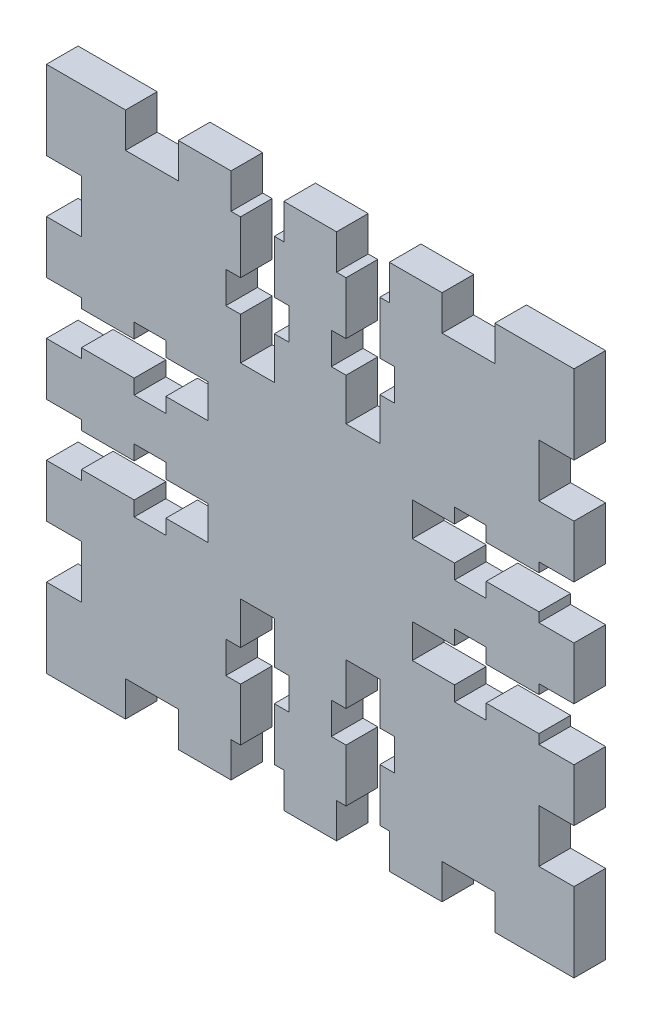
from build123d import *

# Parameters (mm, degrees)
SKETCH1_W           = 50
SKETCH1_H           = 50
BOSS_EXTRUDE1_DEPTH = 3
SKETCH2_W           = 5
SKETCH2_H           = 3.320363524
SKETCH2_W_2         = 3.320363524
SKETCH2_H_2         = 5
CUT_EXTRUDE1_DEPTH  = 3
SKETCH4_W           = 3.2
SKETCH4_H           = 3
CUT_EXTRUDE2_DEPTH  = 12
SKETCH5_W           = 3
SKETCH5_H           = 3.2
CUT_EXTRUDE3_DEPTH  = 12
SKETCH6_W           = 3.2
SKETCH6_H           = 3
CUT_EXTRUDE4_DEPTH  = 12
SKETCH8_W           = 3
SKETCH8_H           = 3.2
CUT_EXTRUDE5_DEPTH  = 12
SKETCH9_W           = 6
SKETCH9_H           = 3
SKETCH9_W_2         = 3
SKETCH9_H_2         = 6
CUT_EXTRUDE6_DEPTH  = 12


with BuildPart() as part:
    # Sketch1 → Boss-Extrude1 (new body)
    with BuildSketch(Plane.XY):
        with Locations((3.733082315, -9.148044693)):
            Rectangle(SKETCH1_W, SKETCH1_H)
    extrude(amount=BOSS_EXTRUDE1_DEPTH)

    # Sketch2 → Cut-Extrude1 (cut)
    with BuildSketch(Plane.XY.offset(3)):
        with Locations((-11.266917685, 14.191773545)):
            Rectangle(SKETCH2_W, SKETCH2_H)
        with Locations((8.733082315, 14.191773545)):
            Rectangle(SKETCH2_W, SKETCH2_H)
        with Locations((-1.266917685, 14.191773545)):
            Rectangle(SKETCH2_W, SKETCH2_H)
        with Locations((18.733082315, 14.191773545)):
            Rectangle(SKETCH2_W, SKETCH2_H)
        with Locations((27.072900553, 5.851955307)):
            Rectangle(SKETCH2_W_2, SKETCH2_H_2)
        with Locations((27.072900553, -4.148044693)):
            Rectangle(SKETCH2_W_2, SKETCH2_H_2)
        with Locations((27.072900553, -14.148044693)):
            Rectangle(SKETCH2_W_2, SKETCH2_H_2)
        with Locations((27.072900553, -24.148044693)):
            Rectangle(SKETCH2_W_2, SKETCH2_H_2)
        with Locations((18.733082315, -32.487862931)):
            Rectangle(SKETCH2_W, SKETCH2_H)
        with Locations((8.733082315, -32.487862931)):
            Rectangle(SKETCH2_W, SKETCH2_H)
        with Locations((-1.266917685, -32.487862931)):
            Rectangle(SKETCH2_W, SKETCH2_H)
        with Locations((-11.266917685, -32.487862931)):
            Rectangle(SKETCH2_W, SKETCH2_H)
        with Locations((-19.606735923, -24.148044693)):
            Rectangle(SKETCH2_W_2, SKETCH2_H_2)
        with Locations((-19.606735923, -14.148044693)):
            Rectangle(SKETCH2_W_2, SKETCH2_H_2)
        with Locations((-19.606735923, -4.148044693)):
            Rectangle(SKETCH2_W_2, SKETCH2_H_2)
        with Locations((-19.606735923, 5.851955307)):
            Rectangle(SKETCH2_W_2, SKETCH2_H_2)
    extrude(amount=-CUT_EXTRUDE1_DEPTH, mode=Mode.SUBTRACT)

    # Sketch4 → Cut-Extrude2 (cut)
    with BuildSketch(Plane(origin=(0, 12.531591783, 0), x_dir=(1, 0, 0), z_dir=(0, 1, 0))):
        with Locations((-1.266917685, -1.5)):
            Rectangle(SKETCH4_W, SKETCH4_H)
        with Locations((8.733082315, -1.5)):
            Rectangle(SKETCH4_W, SKETCH4_H)
    extrude(amount=-CUT_EXTRUDE2_DEPTH, mode=Mode.SUBTRACT)

    # Sketch5 → Cut-Extrude3 (cut)
    with BuildSketch(Plane(origin=(25.412718791, 0, 0), x_dir=(0, 0, -1), z_dir=(1, 0, 0))):
        with Locations((-1.5, -4.148044693)):
            Rectangle(SKETCH5_W, SKETCH5_H)
        with Locations((-1.5, -14.148044693)):
            Rectangle(SKETCH5_W, SKETCH5_H)
    extrude(amount=-CUT_EXTRUDE3_DEPTH, mode=Mode.SUBTRACT)

    # Sketch6 → Cut-Extrude4 (cut)
    with BuildSketch(Plane.XZ.offset(30.827681169)):
        with Locations((-1.266917685, 1.5)):
            Rectangle(SKETCH6_W, SKETCH6_H)
        with Locations((8.733082315, 1.5)):
            Rectangle(SKETCH6_W, SKETCH6_H)
    extrude(amount=-CUT_EXTRUDE4_DEPTH, mode=Mode.SUBTRACT)

    # Sketch8 → Cut-Extrude5 (cut)
    with BuildSketch(Plane.ZY.offset(17.946554161)):
        with Locations((1.5, -14.148044693)):
            Rectangle(SKETCH8_W, SKETCH8_H)
        with Locations((1.5, -4.148044693)):
            Rectangle(SKETCH8_W, SKETCH8_H)
    extrude(amount=-CUT_EXTRUDE5_DEPTH, mode=Mode.SUBTRACT)

    # Sketch9 → Cut-Extrude6 (cut)
    with BuildSketch(Plane(origin=(0, 0, 0), x_dir=(-1, 0, 0), z_dir=(0, 0, -1))):
        with Locations((-8.733082315, -24.327681169)):
            Rectangle(SKETCH9_W, SKETCH9_H)
        with Locations((1.266917685, -24.327681169)):
            Rectangle(SKETCH9_W, SKETCH9_H)
        with Locations((-18.912718791, -4.148044693)):
            Rectangle(SKETCH9_W_2, SKETCH9_H_2)
        with Locations((-18.912718791, -14.148044693)):
            Rectangle(SKETCH9_W_2, SKETCH9_H_2)
        with Locations((1.266917685, 6.031591783)):
            Rectangle(SKETCH9_W, SKETCH9_H)
        with Locations((-8.733082315, 6.031591783)):
            Rectangle(SKETCH9_W, SKETCH9_H)
        with Locations((11.446554161, -14.148044693)):
            Rectangle(SKETCH9_W_2, SKETCH9_H_2)
        with Locations((11.446554161, -4.148044693)):
            Rectangle(SKETCH9_W_2, SKETCH9_H_2)
    extrude(amount=-CUT_EXTRUDE6_DEPTH, mode=Mode.SUBTRACT)


solid = part.part
